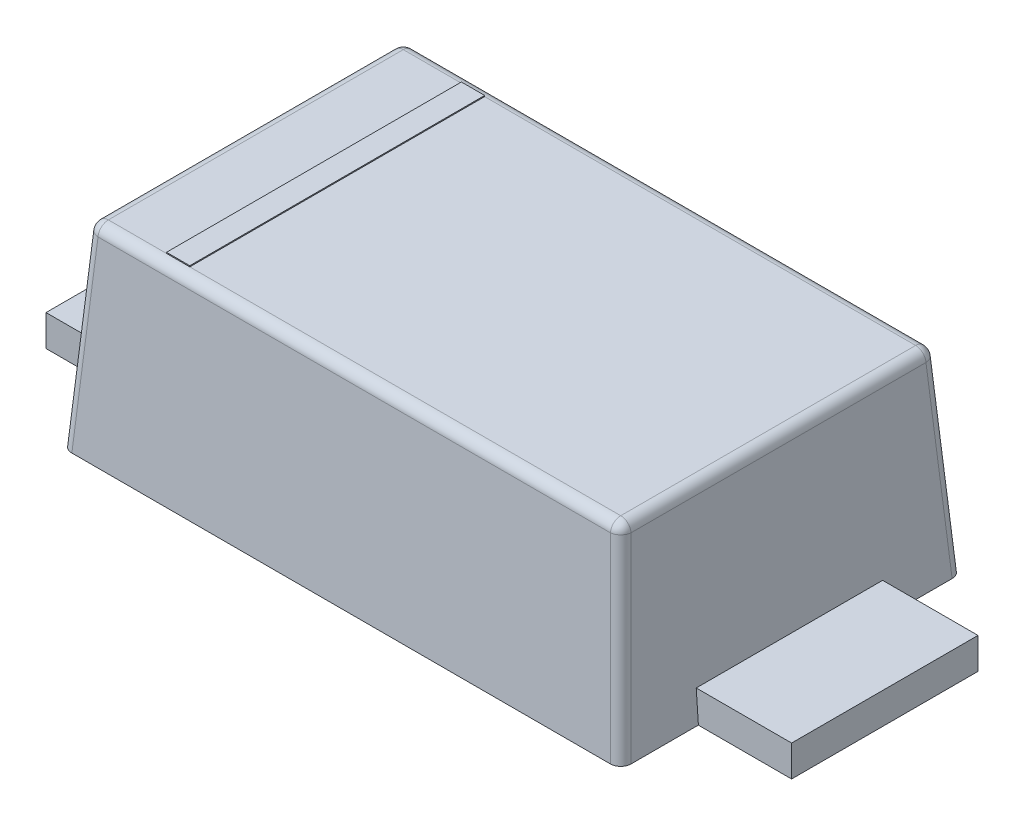
from build123d import *

# Parameters (mm, degrees)
SKETCH2_W           = 2.7
SKETCH2_H           = 1.65
BOSS_EXTRUDE1_DEPTH = 0.95
BOSS_EXTRUDE1_TAPER = 4
FILLET1_R           = 0.05
SKETCH3_W           = 0.75
SKETCH3_H           = 0.9
BOSS_EXTRUDE2_DEPTH = 0.15
SKETCH4_W           = 0.11236269
SKETCH4_H           = 1.423887548
BOSS_EXTRUDE3_DEPTH = 0.005
SKETCH3_2_W         = 0.75
SKETCH3_2_H         = 0.9
BOSS_EXTRUDE4_DEPTH = 0.0005


with BuildPart() as part:
    # Sketch2 → Boss-Extrude1 (new body)
    with BuildSketch(Plane(origin=(0, 0, 0), x_dir=(1, 0, 0), z_dir=(0, 1, 0))):
        Rectangle(SKETCH2_W, SKETCH2_H)
    extrude(amount=BOSS_EXTRUDE1_DEPTH, taper=BOSS_EXTRUDE1_TAPER)

    # Fillet1
    fillet1_edges = [part.edges().sort_by_distance(p)[0] for p in [
        (-1.316784764, 0.475, -0.791784764),
        (-1.316784764, 0.475, 0.791784764),
        (1.316784764, 0.475, 0.791784764),
        (1.316784764, 0.475, -0.791784764),
        (0, 0.95, -0.758569529),
        (1.283569529, 0.95, 0),
        (0, 0.95, 0.758569529),
        (-1.283569529, 0.95, 0),
    ]]
    fillet(fillet1_edges, radius=FILLET1_R)

    # Sketch3 → Boss-Extrude2 (add)
    with BuildSketch(Plane.XZ):
        with Locations((1.425, 0)):
            Rectangle(SKETCH3_W, SKETCH3_H)
        with Locations((-1.425, 0)):
            Rectangle(SKETCH3_W, SKETCH3_H)
    extrude(amount=-BOSS_EXTRUDE2_DEPTH)

    # Sketch4 → Boss-Extrude3 (add)
    with BuildSketch(Plane(origin=(0, 0.95, 0), x_dir=(1, 0, 0), z_dir=(0, 1, 0))):
        with Locations((-0.9, 0)):
            Rectangle(SKETCH4_W, SKETCH4_H)
    extrude(amount=BOSS_EXTRUDE3_DEPTH)

    # Sketch3<2> → Boss-Extrude4 (add)
    with BuildSketch(Plane.XZ):
        with Locations((1.425, 0)):
            Rectangle(SKETCH3_2_W, SKETCH3_2_H)
        with Locations((-1.425, 0)):
            Rectangle(SKETCH3_2_W, SKETCH3_2_H)
    extrude(amount=BOSS_EXTRUDE4_DEPTH)


solid = part.part
